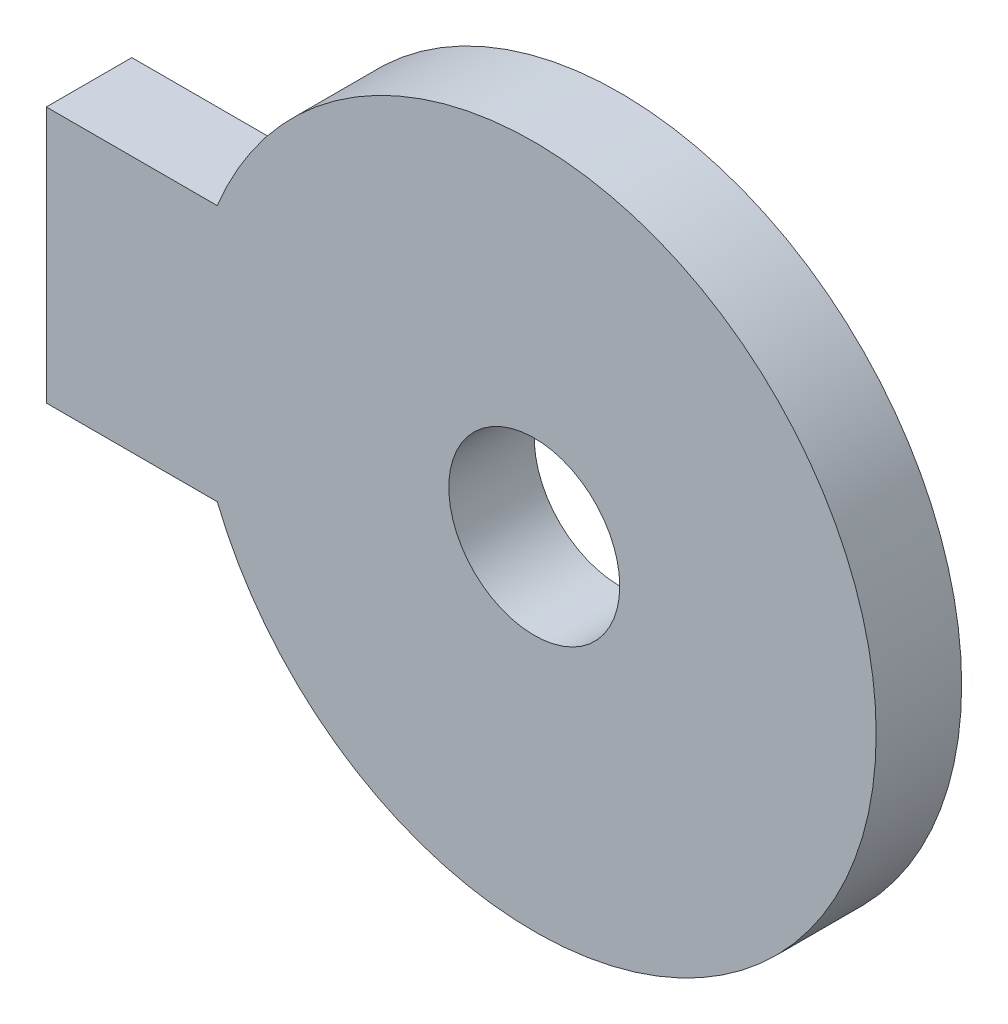
from build123d import *

# Parameters (mm, degrees)
SKETCH1_R           = 5
BOSS_EXTRUDE1_DEPTH = 5


with BuildPart() as part:
    # Sketch1 → Boss-Extrude1 (new body)
    with BuildSketch(Plane.XY):
        with BuildLine():
            Line((-28.540496218, -7.5), (-28.540496218, 7.5))
            Line((-28.540496218, 7.5), (-18.540496218, 7.5))
            ThreePointArc((-18.540496218, 7.5), (20, 0), (-18.540496218, -7.5))
            Line((-18.540496218, -7.5), (-28.540496218, -7.5))
        make_face()
        Circle(SKETCH1_R, mode=Mode.SUBTRACT)
    extrude(amount=BOSS_EXTRUDE1_DEPTH)


solid = part.part
